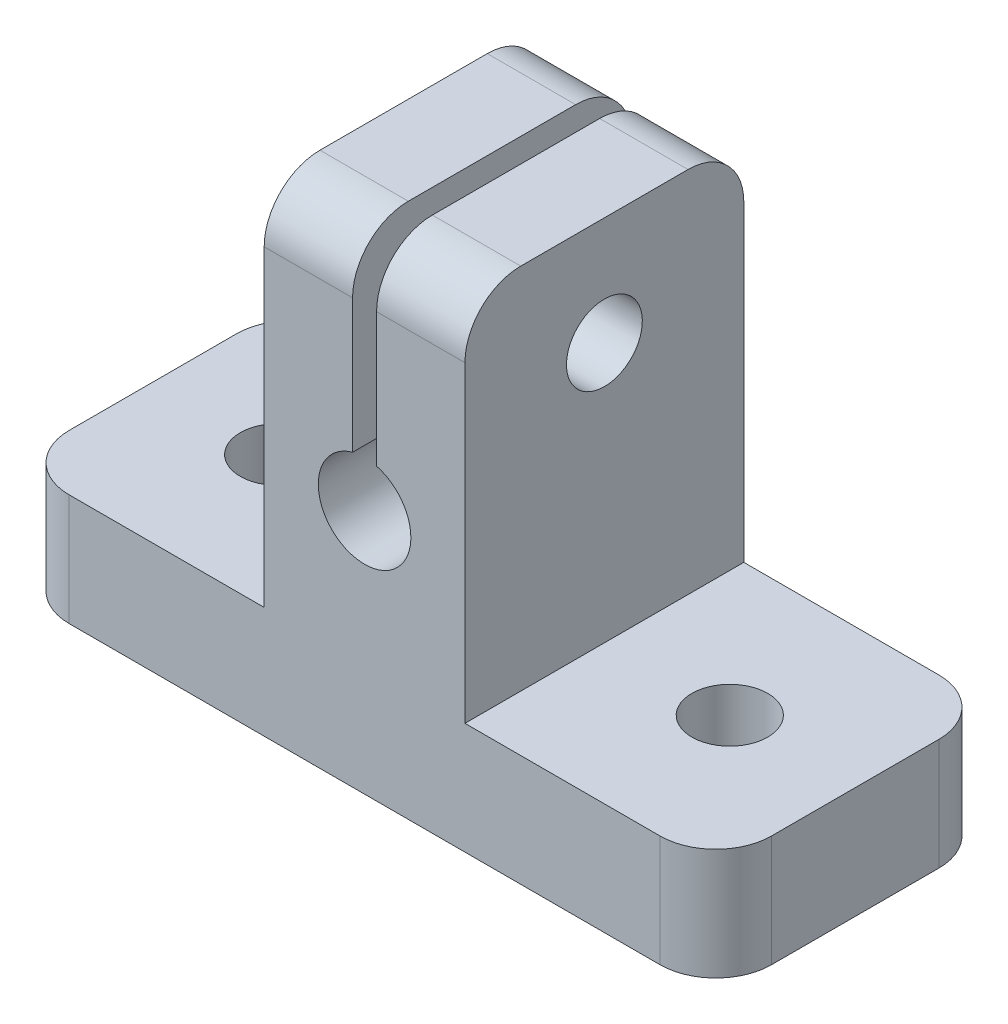
from build123d import *

# Parameters (mm, degrees)
BOSS_EXTRUDE3_DEPTH = 25
SKETCH9_R           = 4.15
CUT_EXTRUDE1_DEPTH  = 25
SKETCH10_R          = 3.4
CUT_EXTRUDE2_DEPTH  = 10
SKETCH11_W          = 2.155120977
SKETCH11_H          = 16.992336916
CUT_EXTRUDE3_DEPTH  = 25
CUT_EXTRUDE4_REACH  = 58.719
SKETCH12_R          = 3.4
FILLET1_R           = 5


with BuildPart() as part:
    # Sketch7 → Boss-Extrude3 (new body)
    with BuildSketch(Plane.XY):
        Polygon((-42.388340788, -20.868913389), (-64.874490575, -20.868913389), (-64.874490575, -30.868913389), (-1.902191, -30.868913389), (-1.902191, -20.868913389), (-24.388340788, -20.868913389), (-24.388340788, 12.131086611), (-42.388340788, 12.131086611), align=None)
    extrude(amount=BOSS_EXTRUDE3_DEPTH)

    # Sketch9 → Cut-Extrude1 (cut)
    with BuildSketch(Plane.XY.offset(25)):
        with Locations((-33.388340788, -8.868913389)):
            Circle(SKETCH9_R)
    extrude(amount=-CUT_EXTRUDE1_DEPTH, mode=Mode.SUBTRACT)

    # Sketch10 → Cut-Extrude2 (cut)
    with BuildSketch(Plane(origin=(0, -20.868913389, 0), x_dir=(-1, 0, 0), z_dir=(0, 1, 0))):
        with Locations((53.631415681, 12.5)):
            Circle(SKETCH10_R)
        with Locations((13.145265894, 12.5)):
            Circle(SKETCH10_R)
    extrude(amount=-CUT_EXTRUDE2_DEPTH, mode=Mode.SUBTRACT)

    # Sketch11 → Cut-Extrude3 (cut)
    with BuildSketch(Plane.XY):
        with Locations((-33.388340787, 3.634918153)):
            Rectangle(SKETCH11_W, SKETCH11_H)
    extrude(amount=CUT_EXTRUDE3_DEPTH, mode=Mode.SUBTRACT)

    # Cut-Extrude4: up to this face of the body (flat: up to its plane)
    cut_extrude4_end = Plane(part.part.faces().sort_by_distance((-24.388340788, -4.368913389, 12.5))[0])
    # Sketch12 → Cut-Extrude4 (cut, up to the picked face)
    with BuildSketch(Plane.ZY.offset(42.388340788), mode=Mode.PRIVATE) as cut_extrude4_sk1:
        with Locations(Location((12.5, 2.423670307, 0), (0, 0, 270))):
            Circle(SKETCH12_R)
    cut_extrude4_tool1 = split(extrude(cut_extrude4_sk1.sketch, amount=-CUT_EXTRUDE4_REACH, mode=Mode.PRIVATE), bisect_by=cut_extrude4_end, keep=Keep.BOTH, mode=Mode.PRIVATE)
    add(cut_extrude4_tool1.solids().sort_by(Axis((-42.388341, 2.42367, 12.5), (1, 0, 0)))[0], mode=Mode.SUBTRACT)

    # Fillet1
    fillet1_edges = [part.edges().sort_by_distance(p)[0] for p in [
        (-64.874490575, -25.868913389, 25),
        (-1.902191, -25.868913389, 25),
        (-28.349560543, 12.131086611, 25),
        (-38.427121032, 12.131086611, 0),
        (-38.427121032, 12.131086611, 25),
        (-28.349560543, 12.131086611, 0),
        (-1.902191, -25.868913389, 0),
        (-64.874490575, -25.868913389, 0),
    ]]
    fillet(fillet1_edges, radius=FILLET1_R)


solid = part.part
